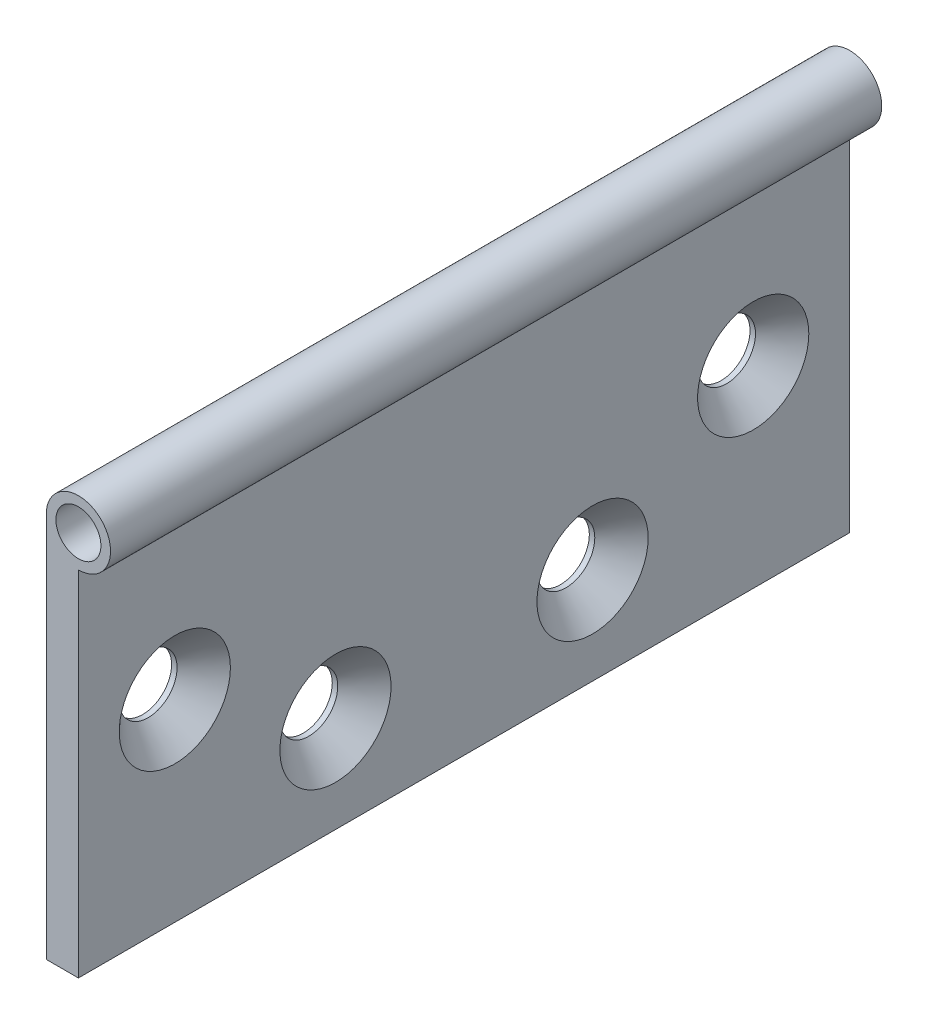
from build123d import *

# Parameters (mm, degrees)
SKETCH_1_W                 = 5
SKETCH_1_H                 = 60
EXTRUDE_691_DEPTH          = 60
SKETCH_2_R                 = 5
SKETCH_4_R                 = 3.5
CUT_EXTRUDE_1_DEPTH        = 137.839321834
HOLE_WIZARD_M81_AT_2_COUNT = 2
HOLE_WIZARD_M81_AT_2_PITCH = 29.154759474


with BuildPart() as part:
    # Эскиз1 → Extrude 691 (new, symmetric)
    with BuildSketch(Plane.XY):
        with Locations((2.5, 30)):
            Rectangle(SKETCH_1_W, SKETCH_1_H)
    extrude(amount=EXTRUDE_691_DEPTH, both=True)

    # По траектории1: sweep along a curve in space
    with BuildLine() as sweep_1_path:
        Line((5, 60, 60), (5, 60, -60))
    # Эскиз2 → По траектории1 (sweep)
    with BuildSketch(Plane.XY.offset(60)):
        with Locations((5, 60)):
            Circle(SKETCH_2_R)
    sweep(path=sweep_1_path.line)

    # Эскиз4 → Вырез-Вытянуть1 (cut, through all)
    with BuildSketch(Plane.XY.offset(60)):
        with Locations((5, 60)):
            Circle(SKETCH_4_R)
    extrude(amount=-CUT_EXTRUDE_1_DEPTH, mode=Mode.SUBTRACT)

    # Эскиз5 → Зенковка для  винта с плоской головкой M81 (revolve, cut)
    with BuildSketch(Plane(origin=(5, 30, 45), x_dir=(0, 0, -1), z_dir=(0, 1, 0))):
        Polygon((0, 0), (0, 5), (4.5, 5), (4.5, 4.15), (8.65, 0), align=None)
    hole_wizard_m81 = revolve(axis=Axis((11.35, 30, 45), (-1, 0, 0)), mode=Mode.SUBTRACT)

    # Зенковка для  винта с плоской головкой M81 at 2: Зенковка для  винта с плоской головкой M81 ×2
    with Locations(*[Vector(0, -0.5144957554275265, -0.8574929257125442) * (i * HOLE_WIZARD_M81_AT_2_PITCH) for i in range(1, HOLE_WIZARD_M81_AT_2_COUNT)]):
        add(hole_wizard_m81, mode=Mode.SUBTRACT)

    # Зеркальное отражение1: Зенковка для  винта с плоской головкой M81 across plane
    add(hole_wizard_m81.mirror(Plane.XY), mode=Mode.SUBTRACT)

    # Зеркальное отражение1 copy 1 sketch → Зеркальное отражение1 copy 1 (revolve, cut)
    with BuildSketch(Plane(origin=(5, 15, -20), x_dir=(0, 0, 1), z_dir=(0, 1, 0))):
        Polygon((0, 0), (0, -5), (4.5, -5), (4.5, -4.15), (8.65, 0), align=None)
    revolve(axis=Axis((11.35, 15, -20), (1, 0, 0)), mode=Mode.SUBTRACT)


solid = part.part
